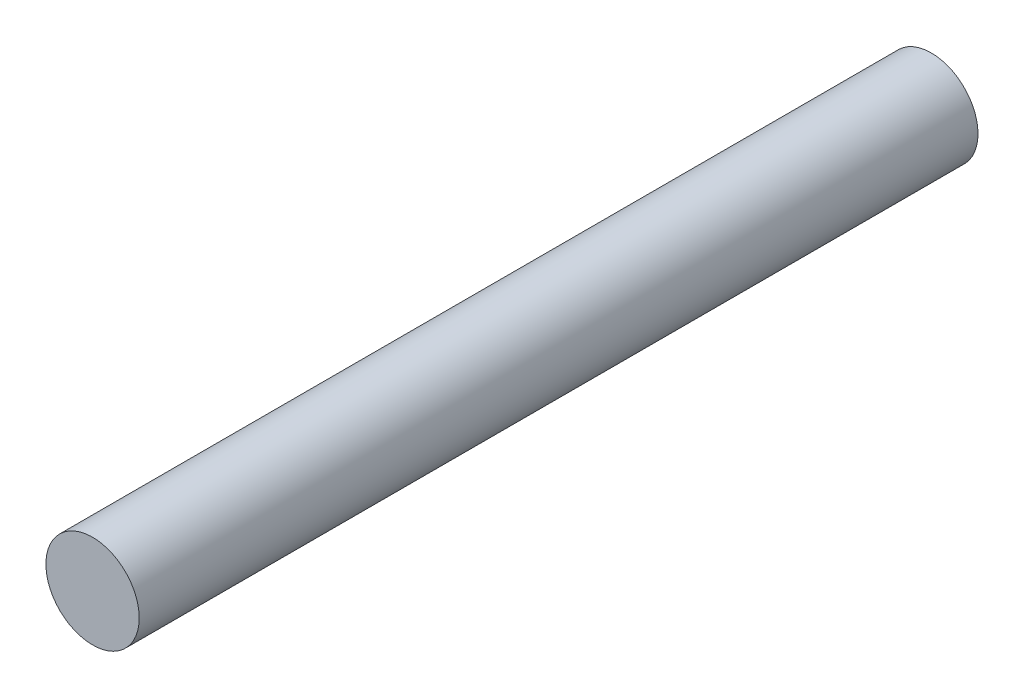
from build123d import *

# Parameters (mm, degrees)
BOSS_EXTRUDE1_DEPTH      = 87
BOSS_EXTRUDE1_DEPTH_BACK = 2
SKETCH1_R                = 4.95


with BuildPart() as part:
    # Sketch1 → Boss-Extrude1 (new, two sides: drawn at the far end of the back side and taken through both)
    with BuildSketch(Plane.XY.offset(-BOSS_EXTRUDE1_DEPTH_BACK)):
        Circle(SKETCH1_R)
    extrude(amount=BOSS_EXTRUDE1_DEPTH + BOSS_EXTRUDE1_DEPTH_BACK)


solid = part.part
